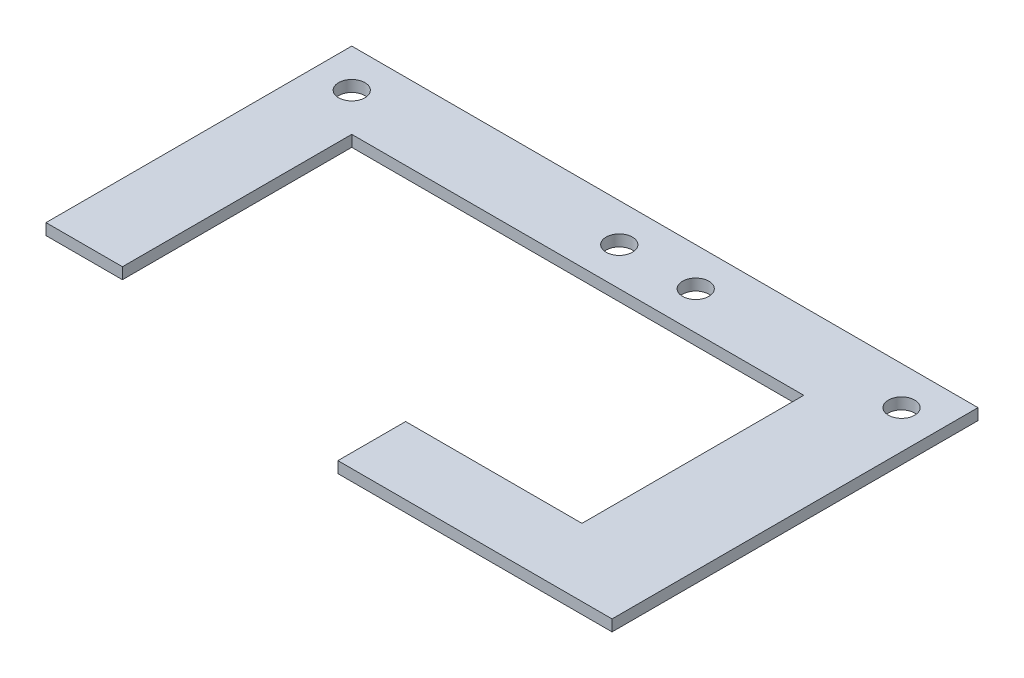
from build123d import *

# Parameters (mm, degrees)
SKETCH1_R           = 1.75
BOSS_EXTRUDE1_DEPTH = 1.5


with BuildPart() as part:
    # Sketch1 → Boss-Extrude1 (new body)
    with BuildSketch(Plane(origin=(0, 0, 0), x_dir=(1, 0, 0), z_dir=(0, 1, 0))):
        Polygon((5.08, -43.56), (-31.36, -43.56), (-31.36, -34.56), (-7.92, -34.56), (-7.92, -5.08), (-68, -5.08), (-68, -35.56), (-78.16, -35.56), (-78.16, 5.08), (5.08, 5.08), align=None)
        with Locations(Location((0, 0, 0), (0, 0, 270))):
            Circle(SKETCH1_R, mode=Mode.SUBTRACT)
        with Locations(Location((-73.08, 0, 0), (0, 0, 270))):
            Circle(SKETCH1_R, mode=Mode.SUBTRACT)
        with Locations(Location((-27.36, 0, 0), (0, 0, 270))):
            Circle(SKETCH1_R, mode=Mode.SUBTRACT)
        with Locations(Location((-37.52, 0, 0), (0, 0, 270))):
            Circle(SKETCH1_R, mode=Mode.SUBTRACT)
    extrude(amount=BOSS_EXTRUDE1_DEPTH)


solid = part.part
